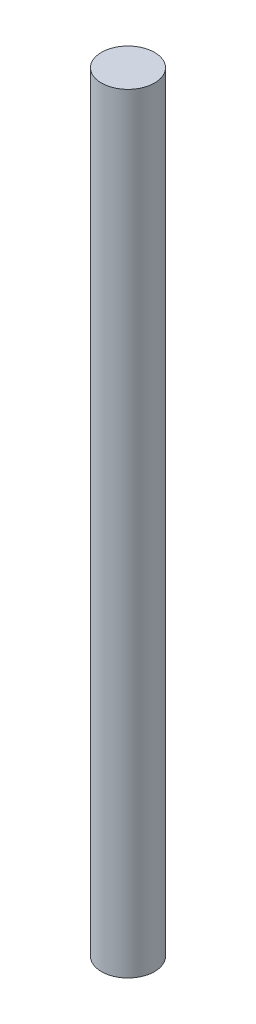
from build123d import *

# Parameters (mm, degrees)
SKETCH1_R           = 1.5875
BOSS_EXTRUDE1_DEPTH = 46


with BuildPart() as part:
    # Sketch1 → Boss-Extrude1 (new body)
    with BuildSketch(Plane(origin=(0, 0, 0), x_dir=(1, 0, 0), z_dir=(0, 1, 0))):
        with Locations(Location((0, 0, 0), (0, 0, 270))):
            Circle(SKETCH1_R)
    extrude(amount=BOSS_EXTRUDE1_DEPTH)


solid = part.part
